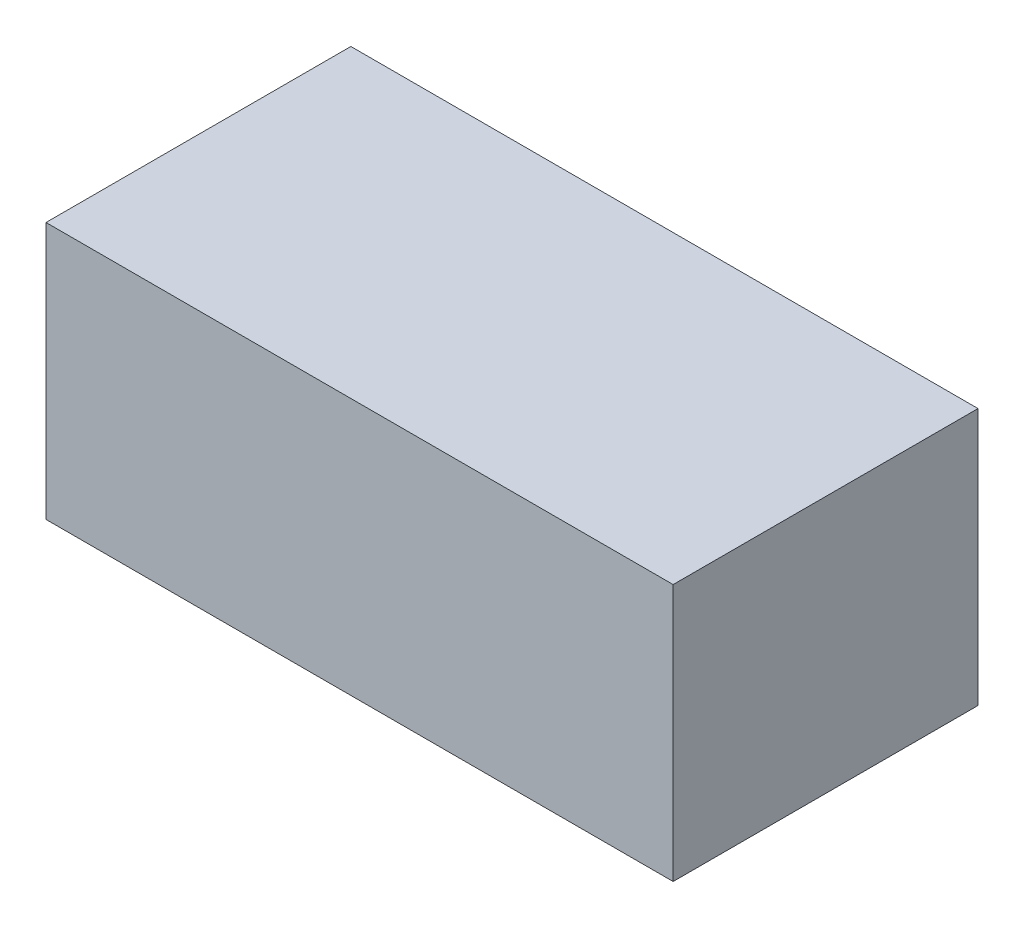
from build123d import *

# Parameters (mm, degrees)
SKETCH1_W           = 1828.8
SKETCH1_H           = 889
BOSS_EXTRUDE1_DEPTH = 750


with BuildPart() as part:
    # Sketch1 → Boss-Extrude1 (new body)
    with BuildSketch(Plane(origin=(0, 0, 0), x_dir=(1, 0, 0), z_dir=(0, 1, 0))):
        Rectangle(SKETCH1_W, SKETCH1_H)
    extrude(amount=BOSS_EXTRUDE1_DEPTH)


solid = part.part
